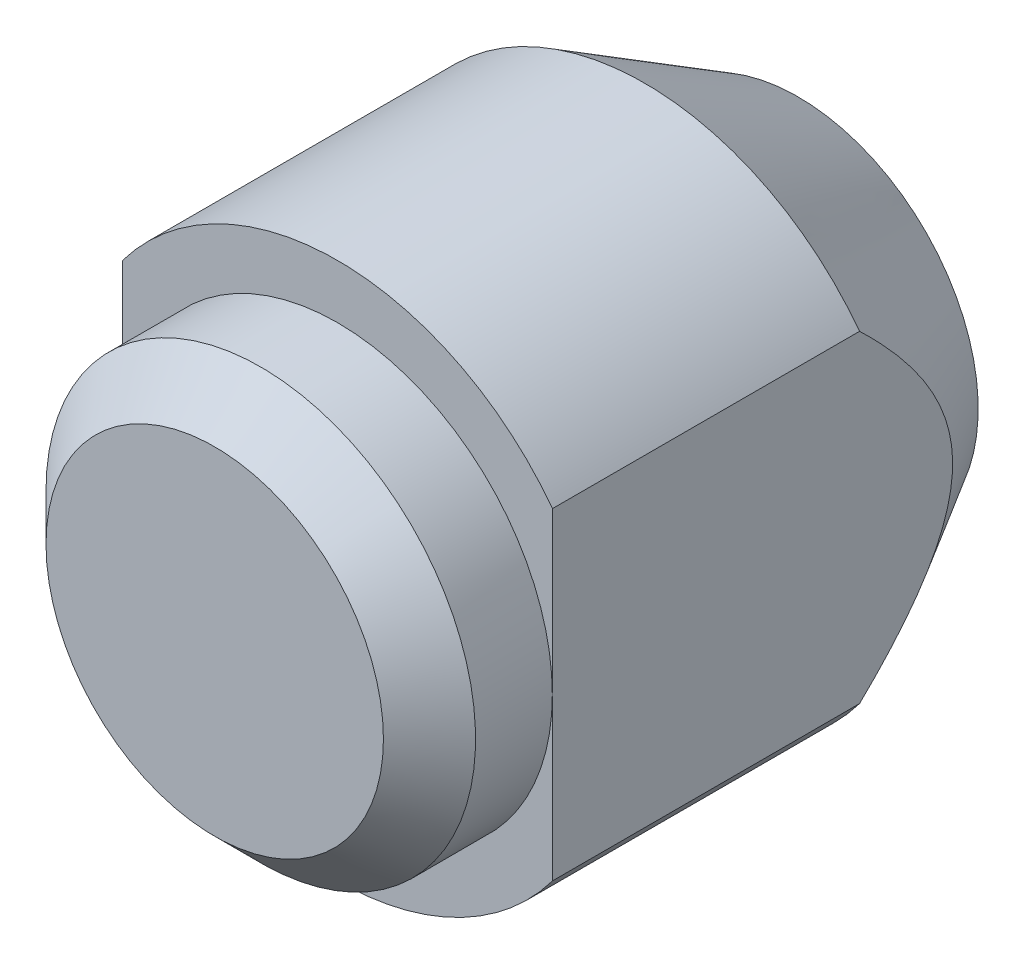
from build123d import *

# Parameters (mm, degrees)
SKETCH_1_R          = 1.75
EXTRUDE_1_DEPTH     = 2
SKETCH_2_R          = 1.39889858
EXTRUDE_2_DEPTH     = 0.8
CHAMFER_1_SIZE      = 0.3
SKETCH_3_R          = 1.75
EXTRUDE_3_DEPTH     = 1
EXTRUDE_3_TAPER     = 30
SKETCH_4_W          = 1.530864342
SKETCH_4_H          = 4.455127657
SKETCH_4_W_2        = 1.518367491
CUT_EXTRUDE_2_DEPTH = 3


with BuildPart() as part:
    # 草图1 → 凸台-拉伸1 (new body)
    with BuildSketch(Plane.XY):
        with Locations((28.584145679, -59.690544666)):
            Circle(SKETCH_1_R)
    extrude(amount=EXTRUDE_1_DEPTH)

    # 草图2 → 凸台-拉伸2 (add)
    with BuildSketch(Plane.XY.offset(2)):
        with Locations((28.584145679, -59.690544666)):
            Circle(SKETCH_2_R)
    extrude(amount=EXTRUDE_2_DEPTH)

    # 倒角1
    chamfer_1_edges = [part.edges().sort_by_distance(p)[0] for p in [
        (27.185247099, -59.690544666, 2.8),
    ]]
    chamfer(chamfer_1_edges, length=CHAMFER_1_SIZE)

    # 草图3 → 凸台-拉伸3 (add)
    with BuildSketch(Plane(origin=(0, 0, 0), x_dir=(-1, 0, 0), z_dir=(0, 0, -1))):
        with Locations((-28.584145679, -59.690544666)):
            Circle(SKETCH_3_R)
    extrude(amount=EXTRUDE_3_DEPTH, taper=EXTRUDE_3_TAPER)

    # 草图4 → 切除-拉伸2 (cut)
    with BuildSketch(Plane(origin=(0, 0, -1), x_dir=(-1, 0, 0), z_dir=(0, 0, -1))):
        with Locations((-26.418713508, -59.807019358)):
            Rectangle(SKETCH_4_W, SKETCH_4_H)
        with Locations((-30.743329425, -59.807019358)):
            Rectangle(SKETCH_4_W_2, SKETCH_4_H)
    extrude(amount=-CUT_EXTRUDE_2_DEPTH, mode=Mode.SUBTRACT)


solid = part.part
